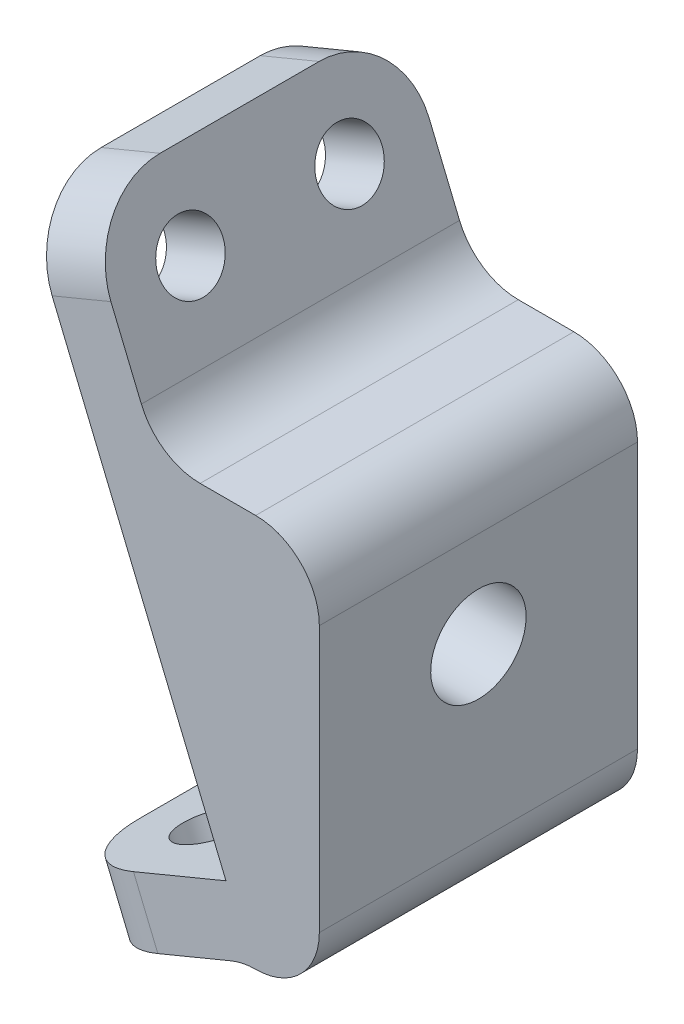
from build123d import *

# Parameters (mm, degrees)
BOSS_EXTRUDE1_DEPTH     = 15.875
CUT_EXTRUDE1_DEPTH      = 50.746098851
CUT_EXTRUDE1_DEPTH_BACK = 50.746098851
SKETCH3_R               = 3.2385
CUT_EXTRUDE2_DEPTH      = 81.103629898
CUT_EXTRUDE2_DEPTH_BACK = 81.103629898
SKETCH4_R               = 3.2385
SKETCH5_R               = 4.7625
CUT_EXTRUDE3_DEPTH      = 49.185254021


with BuildPart() as part:
    # Sketch1 → Boss-Extrude1 (new, symmetric)
    with BuildSketch(Plane.XY):
        with BuildLine():
            Line((50.8, 9.525), (50.8, -17.000540456))
            ThreePointArc((50.8, -17.000540456), (48.940128061, -21.490668516), (44.45, -23.350540456))
            ThreePointArc((44.45, -23.350540456), (43.211176455, -23.472553925), (42.019960204, -23.833905424))
            Line((42.019960204, -23.833905424), (27.353372626, -29.909004913))
            Line((27.353372626, -29.909004913), (24.92333283, -24.042369881))
            Line((24.92333283, -24.042369881), (41.483374135, -17.18297618))
            Line((41.483374135, -17.18297618), (21.098067328, 32.031507988))
            Line((21.098067328, 32.031507988), (26.964702359, 34.461547783))
            Line((26.964702359, 34.461547783), (33.039801848, 19.794960204))
            ThreePointArc((33.039801848, 19.794960204), (35.3785659, 16.945167962), (38.906436879, 15.875))
            Line((38.906436879, 15.875), (44.45, 15.875))
            ThreePointArc((44.45, 15.875), (48.940128061, 14.015128061), (50.8, 9.525))
        make_face()
    extrude(amount=BOSS_EXTRUDE1_DEPTH, both=True)

    # Sketch3 → Cut-Extrude1 (cut, two sides: drawn at the far end of the back side and taken through both)
    with BuildSketch(Plane(origin=(35.199810189, 14.580238773, 0), x_dir=(0, 0, -1), z_dir=(0.9238795325112886, 0.3826834323650853, 0)).offset(-CUT_EXTRUDE1_DEPTH_BACK)):
        with Locations((-7.9375, 13.581873804)):
            Circle(SKETCH3_R)
        with Locations((7.9375, 13.581873804)):
            Circle(SKETCH3_R)
        with BuildLine():
            Line((-15.875, 13.581873804), (-15.875, 21.519373804))
            Line((-15.875, 21.519373804), (-7.9375, 21.519373804))
            ThreePointArc((-7.9375, 21.519373804), (-13.550160076, 19.19453388), (-15.875, 13.581873804))
        make_face()
        with BuildLine():
            Line((7.9375, 21.519373804), (15.875, 21.519373804))
            Line((15.875, 21.519373804), (15.875, 13.581873804))
            ThreePointArc((15.875, 13.581873804), (13.550160076, 19.19453388), (7.9375, 21.519373804))
        make_face()
    extrude(amount=CUT_EXTRUDE1_DEPTH + CUT_EXTRUDE1_DEPTH_BACK, mode=Mode.SUBTRACT)

    # Sketch4 → Cut-Extrude2 (cut, two sides: drawn at the far end of the back side and taken through both)
    with BuildSketch(Plane(origin=(14.580238773, -35.199810189, 0), x_dir=(-0.9238795325112892, -0.3826834323650842, 0), z_dir=(0.3826834323650842, -0.9238795325112892, 0)).offset(-CUT_EXTRUDE2_DEPTH_BACK)):
        with Locations((-21.763040456, -7.9375)):
            Circle(SKETCH4_R)
        with Locations((-21.763040456, 7.9375)):
            Circle(SKETCH4_R)
        with BuildLine():
            Line((-13.825540456, -7.9375), (-13.825540456, -15.875))
            Line((-13.825540456, -15.875), (-21.763040456, -15.875))
            ThreePointArc((-21.763040456, -15.875), (-16.15038038, -13.550160076), (-13.825540456, -7.9375))
        make_face()
        with BuildLine():
            Line((-13.825540456, 7.9375), (-13.825540456, 15.875))
            Line((-13.825540456, 15.875), (-21.763040456, 15.875))
            ThreePointArc((-21.763040456, 15.875), (-16.15038038, 13.550160076), (-13.825540456, 7.9375))
        make_face()
    extrude(amount=CUT_EXTRUDE2_DEPTH + CUT_EXTRUDE2_DEPTH_BACK, mode=Mode.SUBTRACT)

    # Sketch5 → Cut-Extrude3 (cut, through all)
    with BuildSketch(Plane(origin=(50.8, 0, 0), x_dir=(0, 0, -1), z_dir=(1, 0, 0))):
        Circle(SKETCH5_R)
    extrude(amount=-CUT_EXTRUDE3_DEPTH, mode=Mode.SUBTRACT)


solid = part.part
